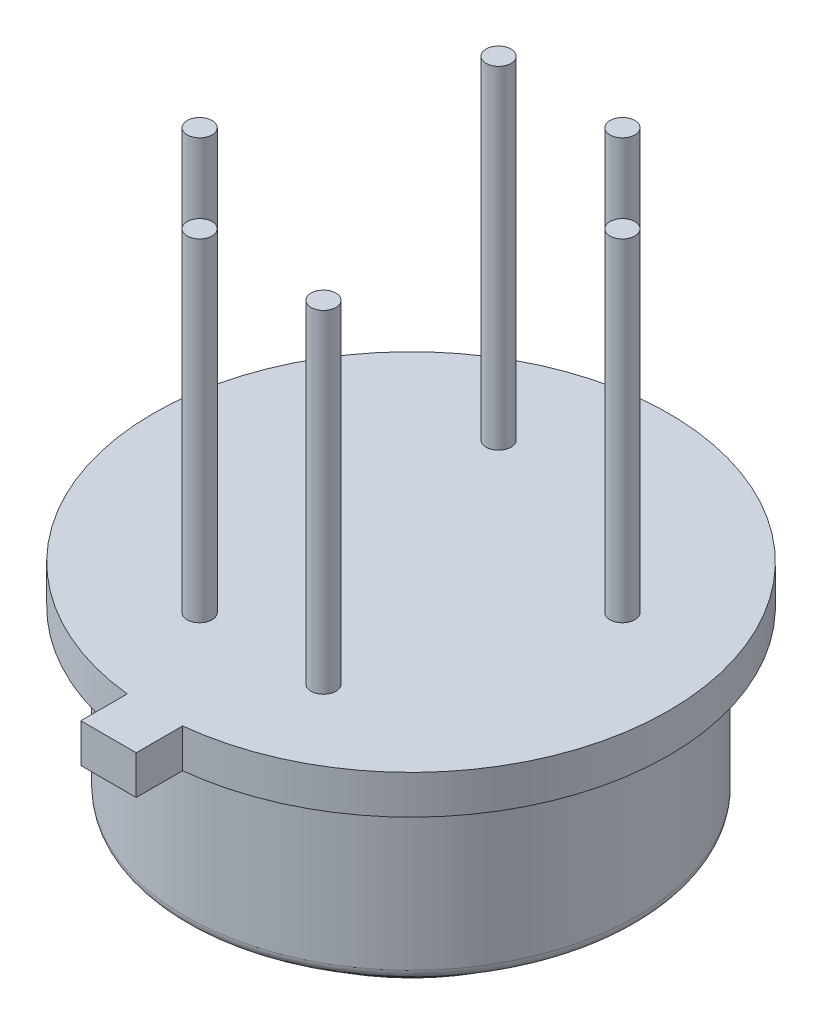
from build123d import *

# Parameters (mm, degrees)
SKETCH1_R           = 4.65
BOSS_EXTRUDE1_DEPTH = 0.7
SKETCH2_R           = 4.075
BOSS_EXTRUDE2_DEPTH = 3
SKETCH3_R           = 3.25
BOSS_EXTRUDE3_DEPTH = 0.6
FILLET1_R           = 0.2
FILLET2_R           = 0.2
SKETCH4_R           = 1.25
CUT_EXTRUDE1_DEPTH  = 0.4
SKETCH5_W           = 1
SKETCH5_H           = 1.626707286
BOSS_EXTRUDE4_DEPTH = 0.7
SKETCH6_R           = 0.225
BOSS_EXTRUDE5_DEPTH = 6


with BuildPart() as part:
    # Sketch1 → Boss-Extrude1 (new body)
    with BuildSketch(Plane(origin=(0, 0, 0), x_dir=(1, 0, 0), z_dir=(0, 1, 0))):
        with Locations(Location((22.683106859, -14.228561536, 0), (0, 0, 270))):
            Circle(SKETCH1_R)
    extrude(amount=BOSS_EXTRUDE1_DEPTH)

    # Sketch2 → Boss-Extrude2 (add)
    with BuildSketch(Plane.XZ):
        with Locations(Location((22.683106859, 14.228561536, 0), (0, 0, 270))):
            Circle(SKETCH2_R)
    extrude(amount=BOSS_EXTRUDE2_DEPTH)

    # Sketch3 → Boss-Extrude3 (add)
    with BuildSketch(Plane.XZ.offset(3)):
        with Locations(Location((22.683106859, 14.228561536, 0), (0, 0, 270))):
            Circle(SKETCH3_R)
    extrude(amount=BOSS_EXTRUDE3_DEPTH)

    # Fillet1
    fillet1_edges = [part.edges().sort_by_distance(p)[0] for p in [
        (22.683106859, -3, 18.303561536),
    ]]
    fillet(fillet1_edges, radius=FILLET1_R)

    # Fillet2
    fillet2_edges = [part.edges().sort_by_distance(p)[0] for p in [
        (22.683106859, -3.6, 17.478561536),
    ]]
    fillet(fillet2_edges, radius=FILLET2_R)

    # Sketch4 → Cut-Extrude1 (cut)
    with BuildSketch(Plane.XZ.offset(3.6)):
        with Locations(Location((22.683106859, 14.228561536, 0), (0, 0, 270))):
            Circle(SKETCH4_R)
    extrude(amount=-CUT_EXTRUDE1_DEPTH, mode=Mode.SUBTRACT)

    # Sketch5 → Boss-Extrude4 (add)
    with BuildSketch(Plane(origin=(0, 0.7, 0), x_dir=(1, 0, 0), z_dir=(0, 1, 0))):
        with Locations((22.683106859, -18.875207893)):
            Rectangle(SKETCH5_W, SKETCH5_H)
    extrude(amount=-BOSS_EXTRUDE4_DEPTH)

    # Sketch6 → Boss-Extrude5 (add)
    with BuildSketch(Plane(origin=(0, 0.7, 0), x_dir=(1, 0, 0), z_dir=(0, 1, 0))):
        with Locations(Location((19.985378624, -15.345997158, 0), (0, 0, 270))):
            Circle(SKETCH6_R)
        with Locations(Location((21.565671236, -16.926289771, 0), (0, 0, 270))):
            Circle(SKETCH6_R)
        with Locations(Location((23.800542481, -16.926289771, 0), (0, 0, 270))):
            Circle(SKETCH6_R)
        with Locations(Location((25.380835094, -13.111125913, 0), (0, 0, 270))):
            Circle(SKETCH6_R)
        with Locations(Location((23.800542481, -11.530833301, 0), (0, 0, 270))):
            Circle(SKETCH6_R)
        with Locations(Location((21.565671236, -11.530833301, 0), (0, 0, 270))):
            Circle(SKETCH6_R)
    extrude(amount=BOSS_EXTRUDE5_DEPTH)


solid = part.part
